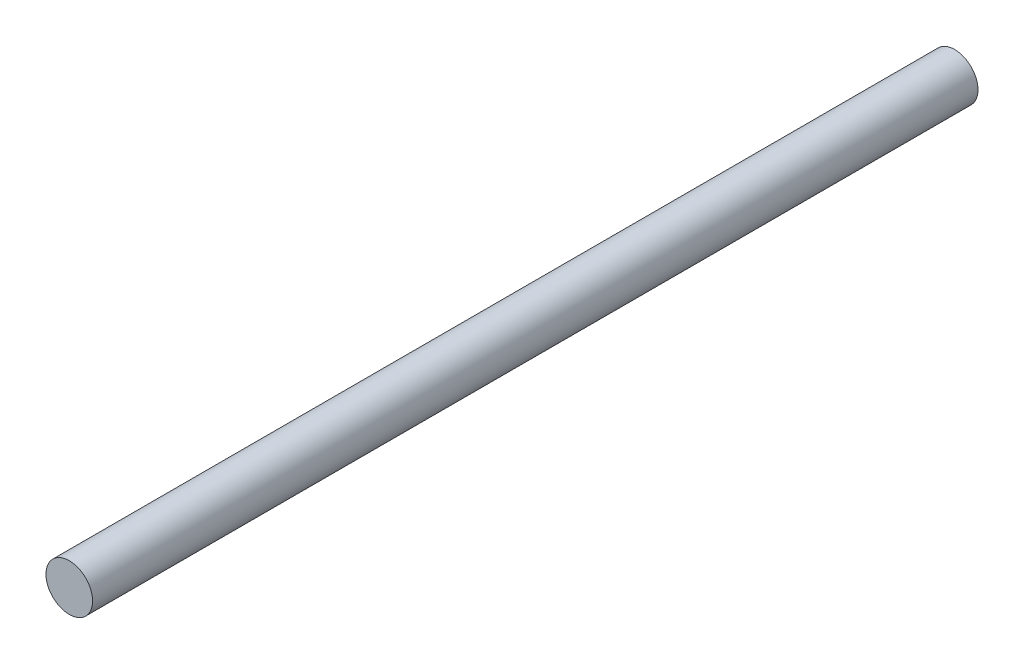
from build123d import *

# Parameters (mm, degrees)
SKETCH_1_R      = 2.5
EXTRUDE_1_DEPTH = 95


with BuildPart() as part:
    # 草圖1 → 填料-伸長1 (new body)
    with BuildSketch(Plane.XY):
        Circle(SKETCH_1_R)
    extrude(amount=EXTRUDE_1_DEPTH)


solid = part.part
